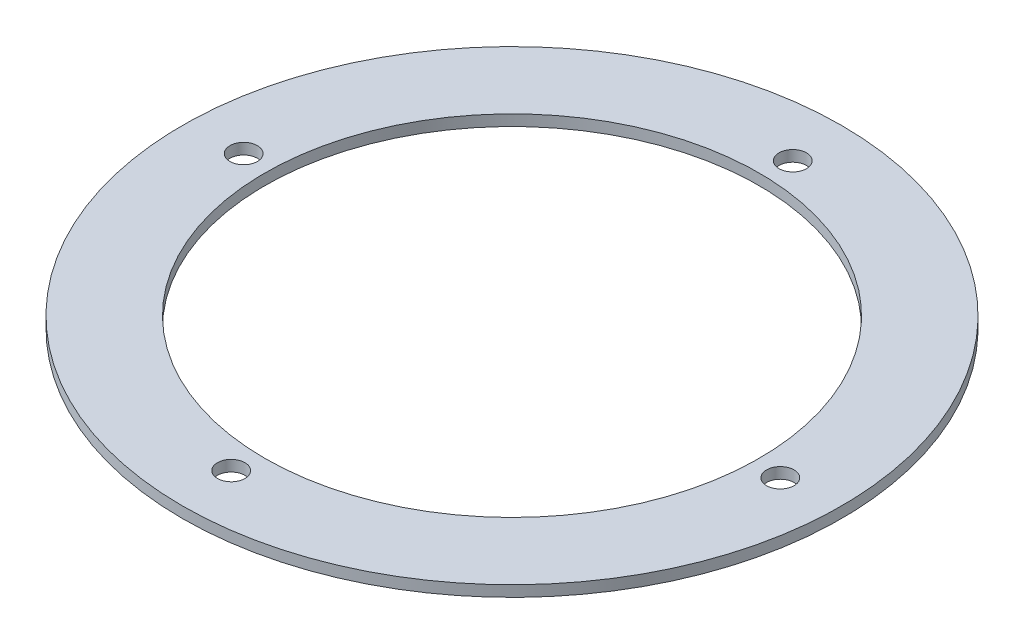
from build123d import *

# Parameters (mm, degrees)
SKETCH_1_R      = 60
SKETCH_1_R_2    = 45
SKETCH_1_R_3    = 2.5
EXTRUDE_1_DEPTH = 2


with BuildPart() as part:
    # 草图1 → 凸台-拉伸1 (new body)
    with BuildSketch(Plane(origin=(0, 0, 0), x_dir=(1, 0, 0), z_dir=(0, 1, 0))):
        with Locations(Location((0, 0, 0), (0, 0, 270))):
            Circle(SKETCH_1_R)
        with Locations(Location((0, 0, 0), (0, 0, 270))):
            Circle(SKETCH_1_R_2, mode=Mode.SUBTRACT)
        with Locations(Location((1.133429405, 49.987151727, 0), (0, 0, 270))):
            Circle(SKETCH_1_R_3, mode=Mode.SUBTRACT)
        with Locations(Location((49.987151727, -1.133429405, 0), (0, 0, 270))):
            Circle(SKETCH_1_R_3, mode=Mode.SUBTRACT)
        with Locations(Location((-1.133429405, -49.987151727, 0), (0, 0, 270))):
            Circle(SKETCH_1_R_3, mode=Mode.SUBTRACT)
        with Locations(Location((-49.987151727, 1.133429405, 0), (0, 0, 270))):
            Circle(SKETCH_1_R_3, mode=Mode.SUBTRACT)
    extrude(amount=EXTRUDE_1_DEPTH)


solid = part.part
